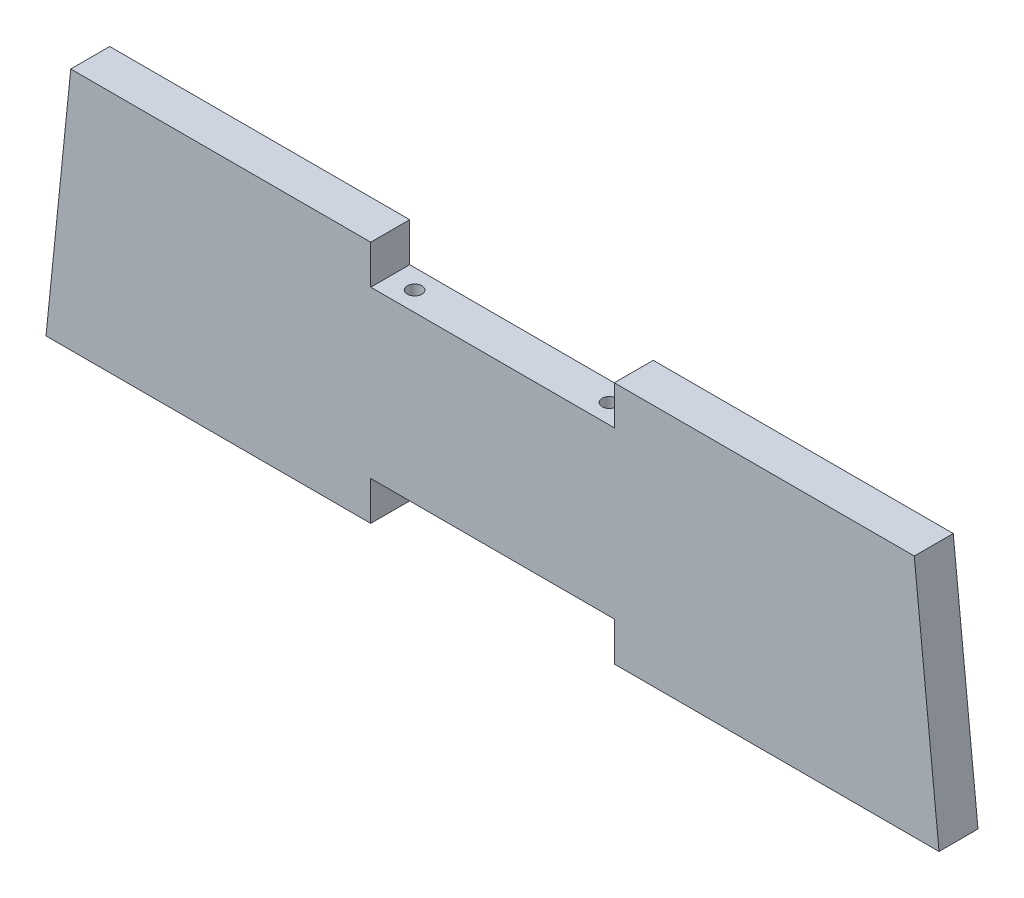
from build123d import *

# Parameters (mm, degrees)
SIDE_BOSS_EXTRUDE1_DEPTH                 = 4
SIDE_BOSS_EXTRUDE1_DEPTH_BACK            = 4
SKETCH3_W                                = 50
SKETCH3_H                                = 8
SOCKET_TOP_AND_BOTTOM_CUT_EXTRUDE1_DEPTH = 8
SKETCH4_R                                = 1.5
MOUNTING_HOLES_TOP_CUT_EXTRUDE2_DEPTH    = 10
MOUNTING_START                           = -10
SKETCH5_R                                = 1.5
MOUNTING_HOLES_BOTTOM_CUT_EXTRUDE3_DEPTH = 10


with BuildPart() as part:
    # Sketch2 → Side Boss-Extrude1 (new, two sides: drawn at the far end of the back side and taken through both)
    with BuildSketch(Plane.XY.offset(-SIDE_BOSS_EXTRUDE1_DEPTH_BACK)):
        Polygon((-86.592068141, 50), (86.592068141, 50), (91.670882932, 0), (-91.670882932, 0), align=None)
    extrude(amount=SIDE_BOSS_EXTRUDE1_DEPTH + SIDE_BOSS_EXTRUDE1_DEPTH_BACK)

    # Sketch3 → Socket Top And Bottom Cut-Extrude1 (cut)
    with BuildSketch(Plane.XY.offset(4)):
        with Locations((0, 4)):
            Rectangle(SKETCH3_W, SKETCH3_H)
        Polygon((25, 42), (0, 42), (-25, 42), (-25, 50), (25, 50), align=None)
    extrude(amount=-SOCKET_TOP_AND_BOTTOM_CUT_EXTRUDE1_DEPTH, mode=Mode.SUBTRACT)

    # Sketch4 → Mounting Holes Top Cut-Extrude2 (cut)
    with BuildSketch(Plane(origin=(0, 42, 0), x_dir=(1, 0, 0), z_dir=(0, 1, 0))):
        with Locations(Location((20, 0, 0), (0, 0, 180))):
            Circle(SKETCH4_R)
        with Locations(Location((-20, 0, 0), (0, 0, 180))):
            Circle(SKETCH4_R)
    extrude(amount=-MOUNTING_HOLES_TOP_CUT_EXTRUDE2_DEPTH, mode=Mode.SUBTRACT)

    # Sketch5 → Mounting Holes Bottom Cut-Extrude3 (cut)
    with BuildSketch(Plane.XZ.offset(-8).offset(MOUNTING_START)):
        with Locations(Location((20, 0, 0), (0, 0, 180))):
            Circle(SKETCH5_R)
        with Locations(Location((-20, 0, 0), (0, 0, 180))):
            Circle(SKETCH5_R)
    extrude(amount=MOUNTING_HOLES_BOTTOM_CUT_EXTRUDE3_DEPTH, mode=Mode.SUBTRACT)


solid = part.part
